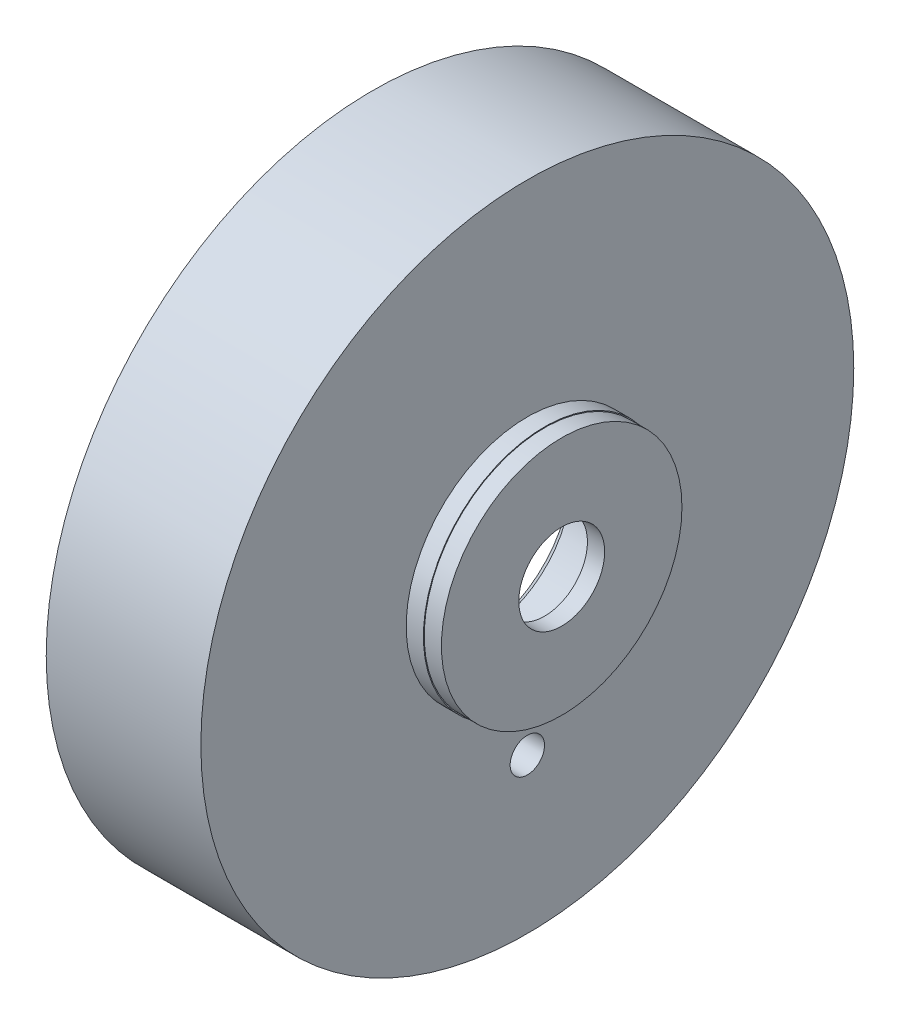
from build123d import *
from build123d.topology import SkipClean

# Parameters (mm, degrees)
BASPROSKE_W             = 5
BASPROSKE_H             = 3.5
TOOTHCUT_DEPTH          = 28.331300737
TEETHCUTS_COUNT         = 33
TEETHCUTS_ANGLE         = 349.090909091
ESQUISSE1_R             = 19
ESQUISSE1_R_2           = 17.751
BOSS_EXTRU_1_DEPTH      = 1
ESQUISSE2_R             = 19
ESQUISSE2_R_2           = 5.05
BOSS_EXTRU_2_DEPTH      = 3
ESQUISSE3_R             = 1
ENL_V_MAT_EXTRU_1_DEPTH = 28.531799796
ESQUISSE4_R             = 2
ENL_V_MAT_EXTRU_2_DEPTH = 1.5
ESQUISSE5_R             = 7.05
ESQUISSE5_R_2           = 5.05
BOSS_EXTRU_4_DEPTH      = 1
ESQUISSE6_R             = 7
ESQUISSE6_R_2           = 2.5
BOSS_EXTRU_5_DEPTH      = 1
CHANFREIN1_SIZE         = 0.5


with BuildPart() as part:
    # BasProSke → Base-Revolve (revolve)
    with BuildSketch(Plane(origin=(0, 0, 0), x_dir=(1, 0, 0), z_dir=(0, 1, 0)), mode=Mode.PRIVATE) as base_revolve_sk:
        with Locations((2.5, 17.25)):
            Rectangle(BASPROSKE_W, BASPROSKE_H)
    revolve(base_revolve_sk.sketch.rotate(Axis((-10, 0, 0), (1, 0, 0)), 180), axis=Axis((-10, 0, 0), (1, 0, 0)))

    # TooCutSke → ToothCut (cut, through all)
    with BuildSketch(Plane(origin=(0, 0, 0), x_dir=(0, 0, -1), z_dir=(1, 0, 0))):
        with BuildLine():
            ThreePointArc((1.226742235, 15.425898633), (0.817607038, 16.626147417), (0.22936635, 17.74951808))
            ThreePointArc((0.22936635, 17.74951808), (0, 17.751), (-0.22936635, 17.74951808))
            ThreePointArc((-0.22936635, 17.74951808), (-0.817607038, 16.626147417), (-1.226742235, 15.425898633))
            ThreePointArc((-1.226742235, 15.425898633), (0, 15.4746), (1.226742235, 15.425898633))
        make_face()
    toothcut = extrude(amount=TOOTHCUT_DEPTH, mode=Mode.SUBTRACT)

    # TeethCuts: ToothCut ×33 about axis
    teethcuts_axis = Axis((-10, 0, 0), (1, 0, 0))
    for i in range(1, TEETHCUTS_COUNT):
        add(toothcut.rotate(teethcuts_axis, i * TEETHCUTS_ANGLE / (TEETHCUTS_COUNT - 1)), mode=Mode.SUBTRACT)

    # Esquisse1 → Boss.-Extru.1 (add)
    with SkipClean():  # the faces are left unmerged after this step: merging them gives an invalid solid
        with BuildSketch(Plane(origin=(5, 0, 0), x_dir=(0, 0, -1), z_dir=(1, 0, 0))):
            with Locations(Location((0, 0, 0), (0, 0, 180))):
                Circle(ESQUISSE1_R)
            with Locations(Location((0, 0, 0), (0, 0, 178.013084972))):
                Circle(ESQUISSE1_R_2, mode=Mode.SUBTRACT)
        extrude(amount=BOSS_EXTRU_1_DEPTH)

    # Esquisse2 → Boss.-Extru.2 (add)
    with SkipClean():  # the faces are left unmerged after this step: merging them gives an invalid solid
        with BuildSketch(Plane(origin=(6, 0, 0), x_dir=(0, 0, -1), z_dir=(1, 0, 0))):
            with Locations(Location((0, 0, 0), (0, 0, 180))):
                Circle(ESQUISSE2_R)
            Circle(ESQUISSE2_R_2, mode=Mode.SUBTRACT)
        extrude(amount=BOSS_EXTRU_2_DEPTH)

    # Esquisse3 → Enlèv. mat.-Extru.1 (cut, through all)
    with SkipClean():  # the faces are left unmerged after this step: merging them gives an invalid solid
        with BuildSketch(Plane.ZY.offset(-6)):
            with Locations((0, -10)):
                Circle(ESQUISSE3_R)
        extrude(amount=-ENL_V_MAT_EXTRU_1_DEPTH, mode=Mode.SUBTRACT)

    # Esquisse4 → Enlèv. mat.-Extru.2 (cut)
    with SkipClean():  # the faces are left unmerged after this step: merging them gives an invalid solid
        with BuildSketch(Plane.ZY.offset(-6)):
            with Locations((0, -10)):
                Circle(ESQUISSE4_R)
        extrude(amount=-ENL_V_MAT_EXTRU_2_DEPTH, mode=Mode.SUBTRACT)

    # Esquisse5 → Boss.-Extru.4 (add)
    with SkipClean():  # the faces are left unmerged after this step: merging them gives an invalid solid
        with BuildSketch(Plane(origin=(9, 0, 0), x_dir=(0, 0, -1), z_dir=(1, 0, 0))):
            Circle(ESQUISSE5_R)
            Circle(ESQUISSE5_R_2, mode=Mode.SUBTRACT)
        extrude(amount=BOSS_EXTRU_4_DEPTH)

    # Esquisse6 → Boss.-Extru.5 (add)
    with SkipClean():  # the faces are left unmerged after this step: merging them gives an invalid solid
        with BuildSketch(Plane(origin=(10, 0, 0), x_dir=(0, 0, -1), z_dir=(1, 0, 0))):
            Circle(ESQUISSE6_R)
            Circle(ESQUISSE6_R_2, mode=Mode.SUBTRACT)
        extrude(amount=BOSS_EXTRU_5_DEPTH)

    # Chanfrein1
    chanfrein1_edges = [part.edges().sort_by_distance(p)[0] for p in [
        (6, 0, 5.05),
    ]]
    chamfer(chanfrein1_edges, length=CHANFREIN1_SIZE)


solid = part.part
